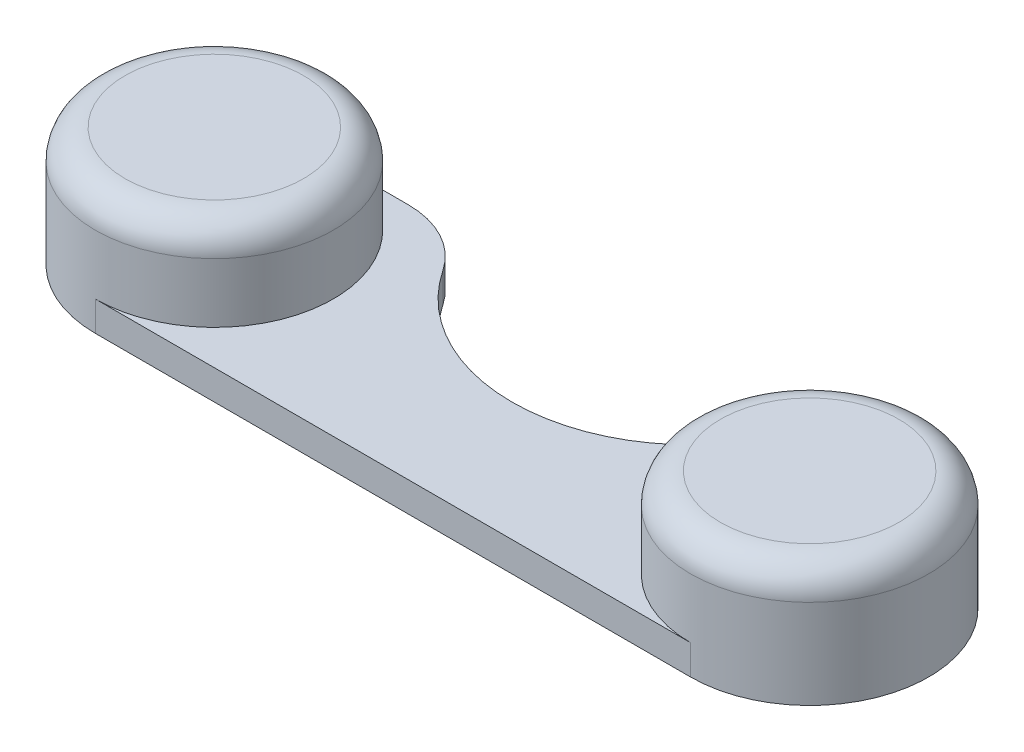
from build123d import *

# Parameters (mm, degrees)
SKETCH1_R             = 4
BOSS_EXTRUDE1_DEPTH   = 4
BOSS_EXTRUDE1_2_DEPTH = 4
FILLET1_R             = 1
FILLET2_R             = 1
SKETCH2_W             = 20
SKETCH2_H             = 8
BOSS_EXTRUDE2_DEPTH   = 1
SKETCH3_R             = 6
CUT_EXTRUDE1_DEPTH    = 1
FILLET3_R             = 3


with BuildPart() as part:
    # Sketch1 → Boss-Extrude1 (new body)
    with BuildSketch(Plane(origin=(0, 0, 0), x_dir=(1, 0, 0), z_dir=(0, 1, 0))):
        with Locations(Location((0, 0, 0), (0, 0, 270))):
            Circle(SKETCH1_R)
    extrude(amount=BOSS_EXTRUDE1_DEPTH)

    # Fillet1
    fillet1_edges = [part.edges().sort_by_distance(p)[0] for p in [
        (0, 4, -4),
    ]]
    fillet(fillet1_edges, radius=FILLET1_R)



with BuildPart() as body_2:
    # Sketch1 → Boss-Extrude1 2 (new body)
    with BuildSketch(Plane(origin=(0, 0, 0), x_dir=(1, 0, 0), z_dir=(0, 1, 0))):
        with Locations(Location((20, 0, 0), (0, 0, 270))):
            Circle(SKETCH1_R)
    extrude(amount=BOSS_EXTRUDE1_2_DEPTH)

    # Fillet2
    fillet2_edges = [body_2.edges().sort_by_distance(p)[0] for p in [
        (20, 4, -4),
    ]]
    fillet(fillet2_edges, radius=FILLET2_R)


with BuildPart() as part_1:
    add(part.part)

    add(body_2.part)  # Boss-Extrude2 merges body 2
    # Sketch2 → Boss-Extrude2 (add)
    with BuildSketch(Plane(origin=(0, 0, 0), x_dir=(-1, 0, 0), z_dir=(0, -1, 0))):
        with Locations((-10, 0)):
            Rectangle(SKETCH2_W, SKETCH2_H)
    extrude(amount=-BOSS_EXTRUDE2_DEPTH)

    # Sketch3 → Cut-Extrude1 (cut)
    with BuildSketch(Plane(origin=(0, 1, 0), x_dir=(1, 0, 0), z_dir=(0, 1, 0))):
        with Locations((10, 6)):
            Circle(SKETCH3_R)
    extrude(amount=-CUT_EXTRUDE1_DEPTH, mode=Mode.SUBTRACT)

    # Fillet3
    fillet3_edges = [part_1.edges().sort_by_distance(p)[0] for p in [
        (4.343145751, 0.5, -4),
        (15.656854249, 0.5, -4),
    ]]
    fillet(fillet3_edges, radius=FILLET3_R)


solid = part_1.part
